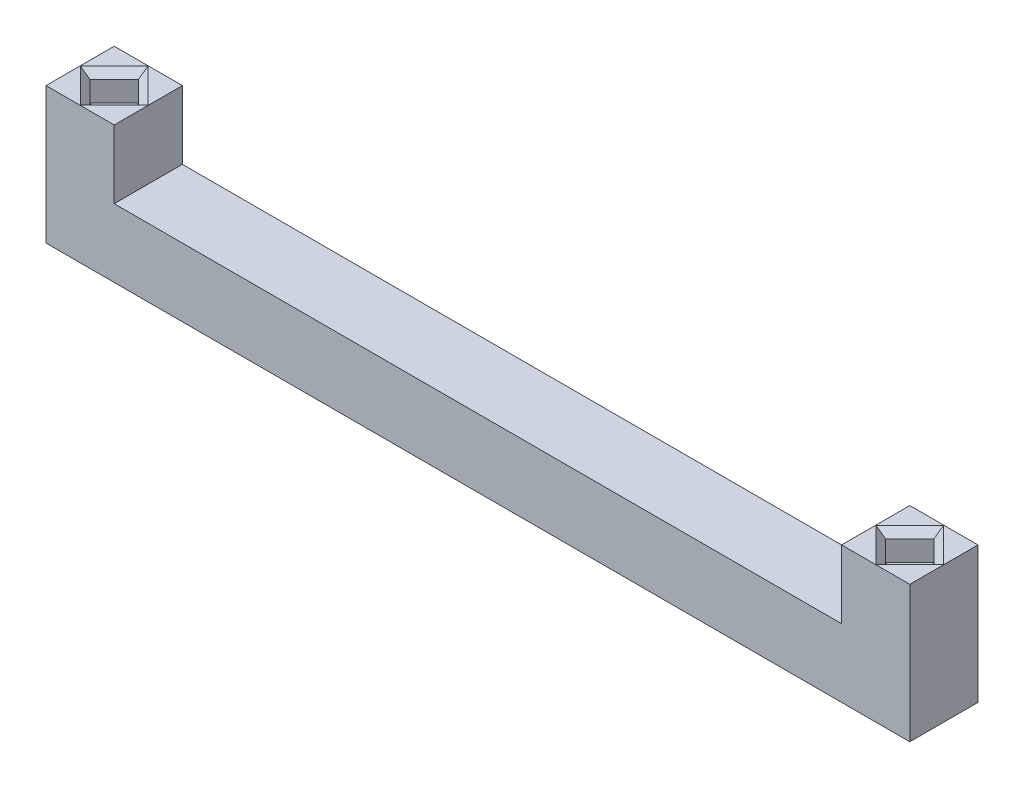
from build123d import *

# Parameters (mm, degrees)
BOSS_EXTRUDE1_DEPTH = 12.7
CUT_EXTRUDE1_DEPTH  = 6.35
CHAMFER1_SIZE       = 1.27


with BuildPart() as part:
    # Sketch1 → Boss-Extrude1 (new body)
    with BuildSketch(Plane.XY):
        Polygon((-80.433333333, 19.05), (-80.433333333, -6.35), (80.433333333, -6.35), (80.433333333, 19.05), (67.733333333, 19.05), (67.733333333, 6.35), (-67.733333333, 6.35), (-67.733333333, 19.05), align=None)
    extrude(amount=BOSS_EXTRUDE1_DEPTH)

    # Sketch2 → Cut-Extrude1 (cut)
    with BuildSketch(Plane(origin=(0, 19.05, 0), x_dir=(1, 0, 0), z_dir=(0, 1, 0))):
        Polygon((-78.573461394, -6.35), (-74.083333333, -1.859871939), (-69.593205273, -6.35), (-74.083333333, -10.840128061), align=None)
        Polygon((69.593205273, -6.35), (74.083333333, -1.859871939), (78.573461394, -6.35), (74.083333333, -10.840128061), align=None)
    extrude(amount=-CUT_EXTRUDE1_DEPTH, mode=Mode.SUBTRACT)

    # Chamfer1
    chamfer1_edges = [part.edges().sort_by_distance(p)[0] for p in [
        (-76.328397364, 12.7, 8.59506403),
        (-76.328397364, 12.7, 4.10493597),
        (-71.838269303, 12.7, 4.10493597),
        (-71.838269303, 12.7, 8.59506403),
        (-76.328397364, 19.05, 8.59506403),
        (-71.838269303, 19.05, 8.59506403),
        (-71.838269303, 19.05, 4.10493597),
        (-76.328397364, 19.05, 4.10493597),
        (71.838269303, 12.7, 8.59506403),
        (71.838269303, 12.7, 4.10493597),
        (76.328397364, 12.7, 4.10493597),
        (76.328397364, 12.7, 8.59506403),
        (71.838269303, 19.05, 8.59506403),
        (76.328397364, 19.05, 8.59506403),
        (76.328397364, 19.05, 4.10493597),
        (71.838269303, 19.05, 4.10493597),
    ]]
    chamfer(chamfer1_edges, length=CHAMFER1_SIZE)


solid = part.part
